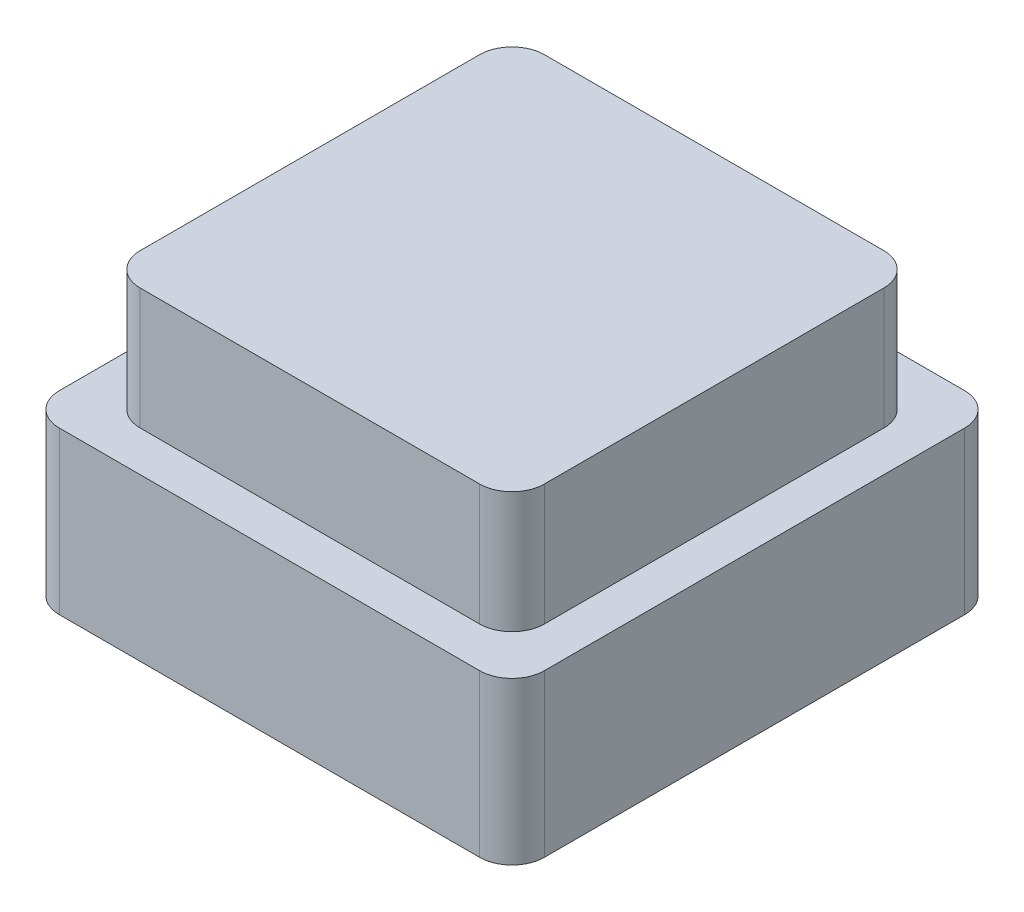
from build123d import *

# Parameters (mm, degrees)
SKETCH1_W           = 38.1
SKETCH1_H           = 38.1
BOSS_EXTRUDE1_DEPTH = 12.7
FILLET1_R           = 2.54
SHELL1_T            = -3.175
FILLET2_R           = 2.54
BOSS_EXTRUDE2_DEPTH = 19.05


with BuildPart() as part:
    # Sketch1 → Boss-Extrude1 (new body)
    with BuildSketch(Plane(origin=(0, 0, 0), x_dir=(1, 0, 0), z_dir=(0, 1, 0))):
        Rectangle(SKETCH1_W, SKETCH1_H)
    extrude(amount=BOSS_EXTRUDE1_DEPTH)

    # Fillet1
    fillet1_edges = [part.edges().sort_by_distance(p)[0] for p in [
        (19.05, 6.35, 19.05),
        (-19.05, 6.35, 19.05),
        (-19.05, 6.35, -19.05),
        (19.05, 6.35, -19.05),
    ]]
    fillet(fillet1_edges, radius=FILLET1_R)

    # Shell1
    shell1_openings = [part.faces().sort_by_distance(p)[0] for p in [
        (0, 12.7, 0),
    ]]
    offset(amount=SHELL1_T, openings=shell1_openings, kind=Kind.INTERSECTION)

    # Fillet2
    fillet2_edges = [part.edges().sort_by_distance(p)[0] for p in [
        (15.875, 7.9375, -15.875),
        (-15.875, 7.9375, -15.875),
        (-15.875, 7.9375, 15.875),
        (15.875, 7.9375, 15.875),
    ]]
    fillet(fillet2_edges, radius=FILLET2_R)

    # Sketch2 → Boss-Extrude2 (add)
    with BuildSketch(Plane(origin=(0, 3.175, 0), x_dir=(1, 0, 0), z_dir=(0, 1, 0))):
        with BuildLine():
            Line((15.875, -13.335), (15.875, 13.335))
            ThreePointArc((15.875, 13.335), (15.131051224, 15.131051224), (13.335, 15.875))
            Line((13.335, 15.875), (-13.335, 15.875))
            ThreePointArc((-13.335, 15.875), (-15.131051224, 15.131051224), (-15.875, 13.335))
            Line((-15.875, 13.335), (-15.875, -13.335))
            ThreePointArc((-15.875, -13.335), (-15.131051224, -15.131051224), (-13.335, -15.875))
            Line((-13.335, -15.875), (13.335, -15.875))
            ThreePointArc((13.335, -15.875), (15.131051224, -15.131051224), (15.875, -13.335))
        make_face()
    extrude(amount=BOSS_EXTRUDE2_DEPTH)


solid = part.part
